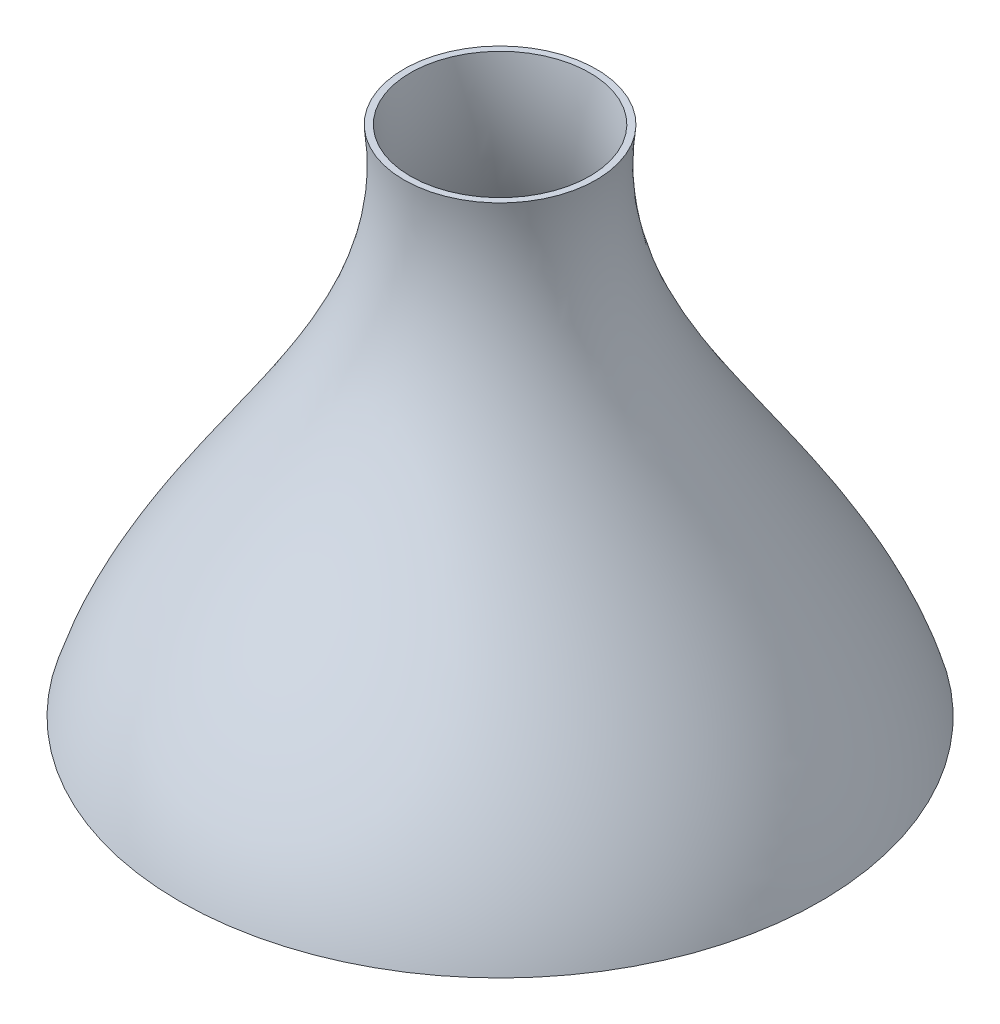
from build123d import *

# Parameters (mm, degrees)
SHELL_1_T           = -1
SKETCH_2_R          = 49.5
CUT_EXTRUDE_1_DEPTH = 1


with BuildPart() as part:
    # 草图1 → 旋转1 (revolve)
    with BuildSketch(Plane.XY):
        with BuildLine():
            Line((0, 46.184538653), (0, -33.815461347))
            Line((0, -33.815461347), (50, -33.815461347))
            add(Edge.make_bspline(
                [(15, 46.184538653), (11.052699624, 14.864352477), (42.005299041, -6.734343286), (50, -33.815461347)],
                knots=[0, 0, 0, 0, 1, 1, 1, 1], degree=3))
            Line((15, 46.184538653), (0, 46.184538653))
        make_face()
    revolve(axis=Axis((0, 46.184538653, 0), (0, -1, 0)))

    # 抽壳1
    shell_1_openings = [part.faces().sort_by_distance(p)[0] for p in [
        (0, 46.184538653, 0),
    ]]
    offset(amount=SHELL_1_T, openings=shell_1_openings, kind=Kind.INTERSECTION)

    # 草图2 → 切除-拉伸1 (cut)
    with BuildSketch(Plane.XZ.offset(33.815461347)):
        with Locations(Location((0, 0, 0), (0, 0, 270))):
            Circle(SKETCH_2_R)
    extrude(amount=-CUT_EXTRUDE_1_DEPTH, mode=Mode.SUBTRACT)


solid = part.part
